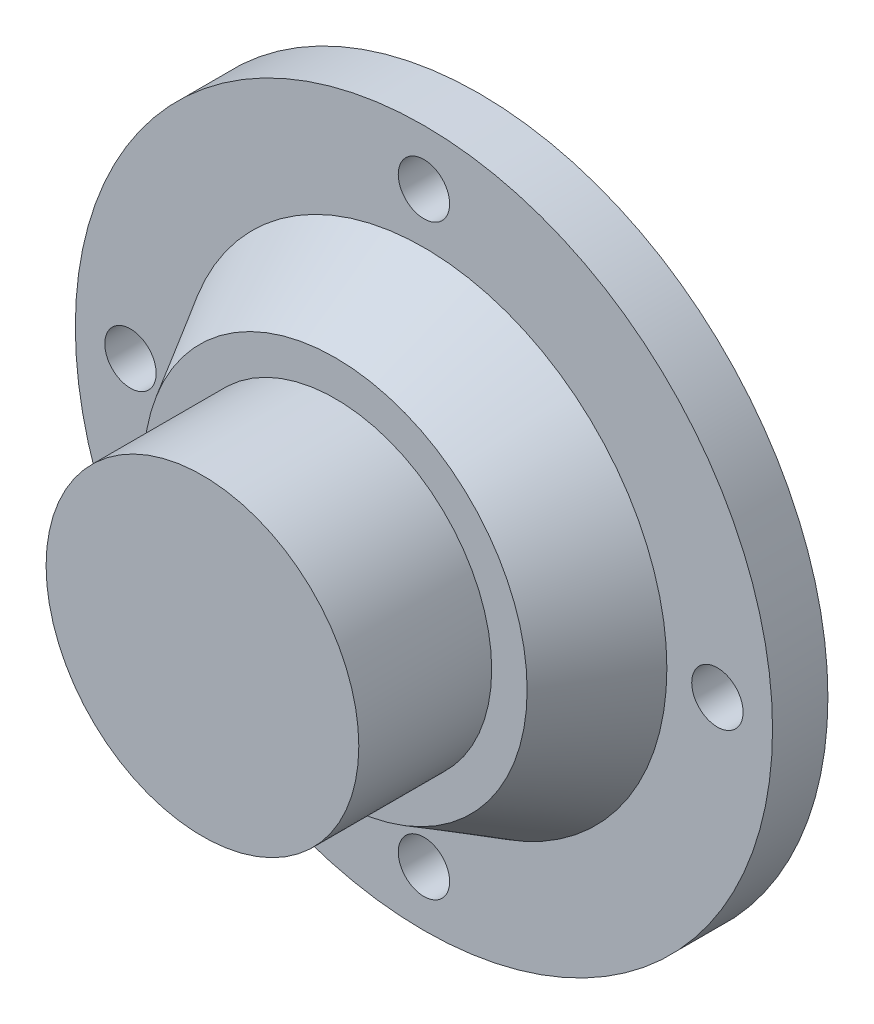
from build123d import *

# Parameters (mm, degrees)
F_4_CLEARANCE_HOLE1_D = 2.9464


with BuildPart() as part:
    # Sketch2 → Revolve1 (revolve)
    with BuildSketch(Plane(origin=(0, 0, 0), x_dir=(0, 0, -1), z_dir=(1, 0, 0)), mode=Mode.PRIVATE) as revolve1_sk:
        Polygon((0, 0), (15.875, 0), (15.875, 17.280736743), (15.875, 19.9898), (12.7, 19.9898), (12.7, 13.931139367), (7.62, 10.9982), (7.62, 8.9662), (0, 8.9662), align=None)
    revolve(revolve1_sk.sketch.rotate(Axis((0, 0, 0), (0, 0, -1)), 90), axis=Axis((0, 0, 0), (0, 0, -1)))

    # #4 Clearance Hole1 (through all)
    with Locations(Plane(origin=(0, 0, -15.875), x_dir=(-1, 0, 0), z_dir=(0, 0, -1))):
        with Locations((0, 16.8275), (-16.8275, 0), (16.8275, 0), (0, -16.8275)):
            Hole(F_4_CLEARANCE_HOLE1_D / 2)


solid = part.part
